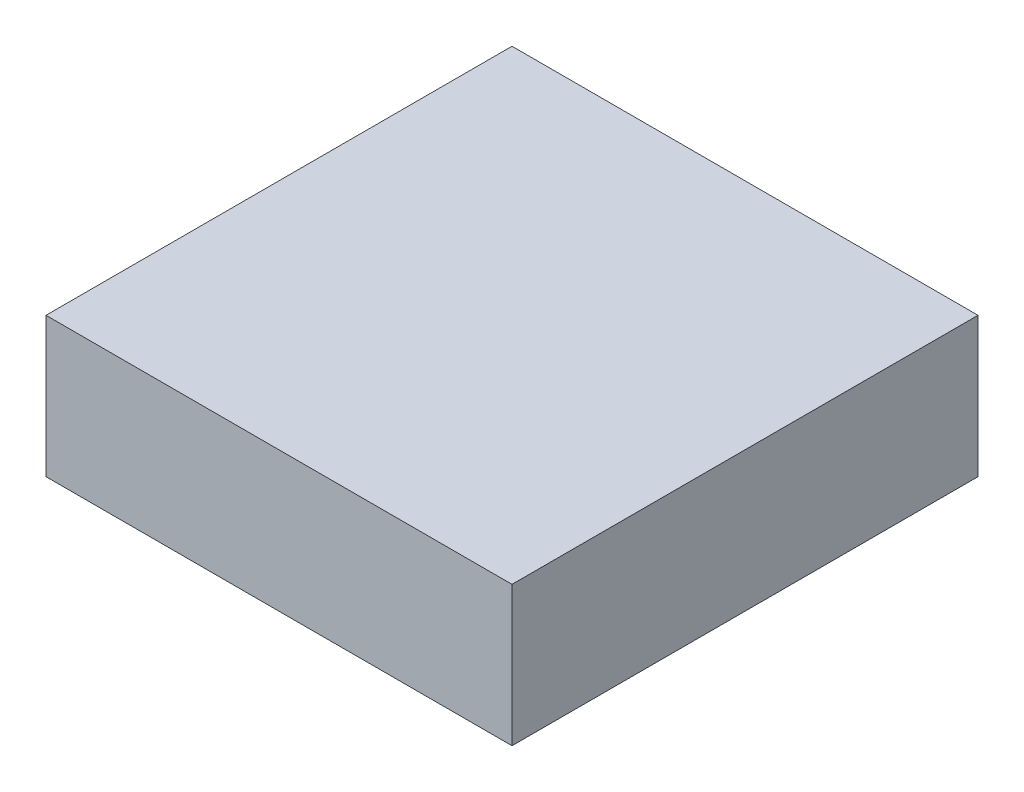
from build123d import *

# Parameters (mm, degrees)
SKETCH_1_W          = 10
SKETCH_1_H          = 10
EXTRUDE_1_DEPTH     = 3
SKETCH_2_W          = 0.84464817
SKETCH_2_H          = 0.749284667
SKETCH_2_W_2        = 0.980881746
SKETCH_2_W_3        = 1.157985395
SKETCH_2_H_2        = 0.899141601
SKETCH_2_W_4        = 1.771036487
SKETCH_2_H_3        = 1.062621892
SKETCH_2_W_5        = 1.253348898
SKETCH_2_H_4        = 1.675672983
SKETCH_2_W_6        = 0.408700727
SKETCH_2_H_5        = 2.070750353
SKETCH_2_W_7        = 1.416829189
SKETCH_2_H_6        = 1.171608752
SKETCH_2_W_8        = 1.593932837
SKETCH_2_H_7        = 1.212478826
CUT_EXTRUDE_1_DEPTH = 1
SKETCH_3_W          = 0.351704959
SKETCH_3_H          = 0.859723233
SKETCH_3_W_2        = 0.371244123
SKETCH_3_H_2        = 1.543593986
SKETCH_3_W_3        = 1.445898165
SKETCH_3_H_3        = 0.429861616
SKETCH_3_W_4        = 1.016036548
SKETCH_3_H_4        = 1.055114877
SKETCH_3_W_5        = 1.11373237
SKETCH_3_H_5        = 0.840184069
SKETCH_3_H_6        = 0.937879891
CUT_EXTRUDE_3_DEPTH = 1


with BuildPart() as part:
    # 草图1 → 凸台-拉伸1 (new body)
    with BuildSketch(Plane(origin=(0, 0, 0), x_dir=(1, 0, 0), z_dir=(0, 1, 0))):
        with Locations((5, 5)):
            Rectangle(SKETCH_1_W, SKETCH_1_H)
    extrude(amount=EXTRUDE_1_DEPTH)

    # 草图2 → 切除-拉伸1 (cut)
    with BuildSketch(Plane(origin=(0, 0, 0), x_dir=(1, 0, 0), z_dir=(0, 1, 0))):
        with Locations((1.130966445, 8.841786839)):
            Rectangle(SKETCH_2_W, SKETCH_2_H)
        with Locations((4.713909491, 8.841786839)):
            Rectangle(SKETCH_2_W_2, SKETCH_2_H)
        with Locations((1.451115349, 0.851687615)):
            Rectangle(SKETCH_2_W_3, SKETCH_2_H_2)
        with Locations((8.419462755, 8.685118227)):
            Rectangle(SKETCH_2_W_4, SKETCH_2_H_3)
        with Locations((3.923754751, 6.362335759)):
            Rectangle(SKETCH_2_W_5, SKETCH_2_H_4)
        with Locations((6.103491964, 5.647109485)):
            Rectangle(SKETCH_2_W_6, SKETCH_2_H_5)
        with Locations((4.005494897, 3.712592708)):
            Rectangle(SKETCH_2_W_7, SKETCH_2_H_6)
        with Locations((5.51087591, 2.261705125)):
            Rectangle(SKETCH_2_W_8, SKETCH_2_H_7)
    extrude(amount=CUT_EXTRUDE_1_DEPTH, mode=Mode.SUBTRACT)

    # 草图3 → 切除-拉伸3 (cut)
    with BuildSketch(Plane(origin=(0, 0, 0), x_dir=(1, 0, 0), z_dir=(0, 1, 0))):
        with Locations((1.934516979, 4.887785167)):
            Rectangle(SKETCH_3_W, SKETCH_3_H)
        with Locations((2.29599152, 7.39856779)):
            Rectangle(SKETCH_3_W_2, SKETCH_3_H_2)
        with Locations((4.415990856, 7.955433975)):
            Rectangle(SKETCH_3_W_3, SKETCH_3_H_3)
        with Locations((7.483639664, 6.099213359)):
            Rectangle(SKETCH_3_W_4, SKETCH_3_H_4)
        with Locations((7.122165123, 3.686126557)):
            Rectangle(SKETCH_3_W_5, SKETCH_3_H_5)
        with Locations((7.815805458, 2.210919646)):
            Rectangle(SKETCH_3_W_4, SKETCH_3_H_6)
    extrude(amount=CUT_EXTRUDE_3_DEPTH, mode=Mode.SUBTRACT)


solid = part.part
